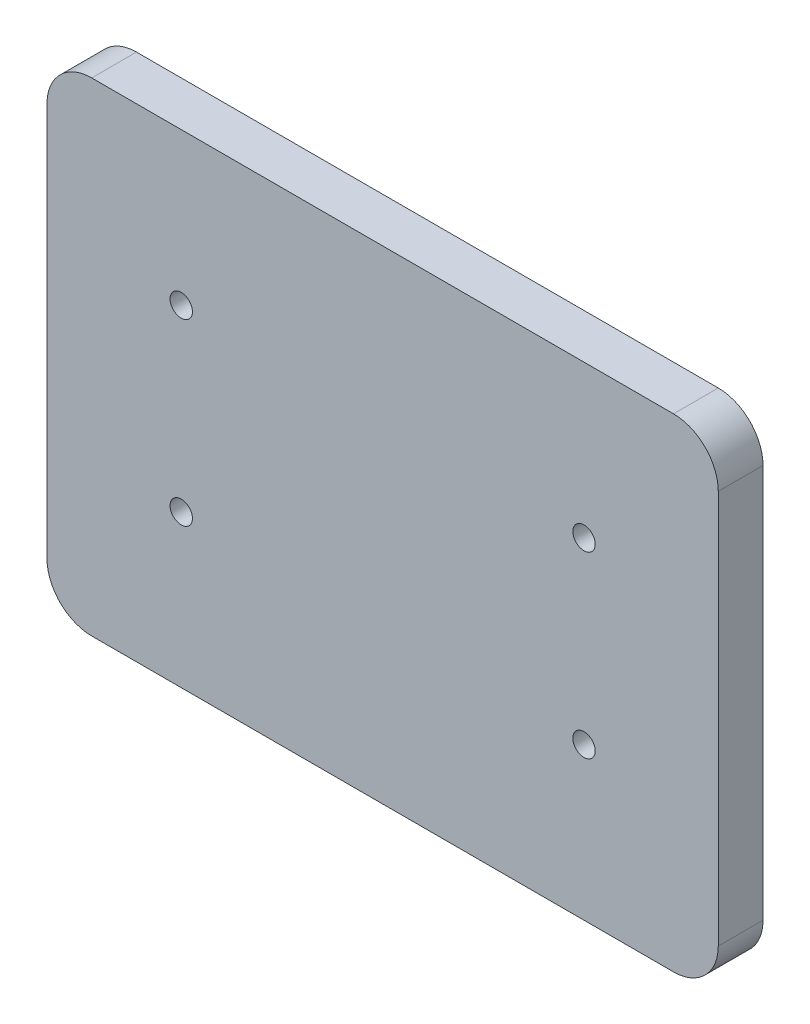
from build123d import *

# Parameters (mm, degrees)
SKETCH1_W                  = 150
SKETCH1_H                  = 108
BOSS_EXTRUDE1_DEPTH        = 10
M6_TAPPED_HOLE1_AT_2_COUNT = 2
M6_TAPPED_HOLE1_AT_2_PITCH = 40
FILLET1_R                  = 10


with BuildPart() as part:
    # Sketch1 → Boss-Extrude1 (new body)
    with BuildSketch(Plane.XY):
        Rectangle(SKETCH1_W, SKETCH1_H)
    extrude(amount=BOSS_EXTRUDE1_DEPTH)

    # Sketch4 → M6 Tapped Hole1 (revolve, cut)
    with BuildSketch(Plane(origin=(-44.997893633, 20, 10), x_dir=(0, -1, 0), z_dir=(1, 0, 0))):
        Polygon((0, 0), (0, 16.502151548), (2.5, 15), (2.5, 0), align=None)
    m6_tapped_hole1 = revolve(axis=Axis((-44.997893633, 20, 16.35), (0, 0, -1)), mode=Mode.SUBTRACT)

    # M6 Tapped Hole1 at 2: M6 Tapped Hole1 ×2
    with Locations(*[(0, -i * M6_TAPPED_HOLE1_AT_2_PITCH, 0) for i in range(1, M6_TAPPED_HOLE1_AT_2_COUNT)]):
        add(m6_tapped_hole1, mode=Mode.SUBTRACT)

    # Mirror1: M6 Tapped Hole1 across plane
    add(m6_tapped_hole1.mirror(Plane(origin=(0, 0, 0), x_dir=(0, 0, 1), z_dir=(1, 0, 0))), mode=Mode.SUBTRACT)

    # Mirror1 copy 1 sketch → Mirror1 copy 1 (revolve, cut)
    with BuildSketch(Plane(origin=(44.997893633, -20, 10), x_dir=(0, -1, 0), z_dir=(-1, 0, 0))):
        Polygon((0, 0), (0, -16.502151548), (2.5, -15), (2.5, 0), align=None)
    revolve(axis=Axis((44.997893633, -20, 16.35), (0, 0, 1)), mode=Mode.SUBTRACT)

    # Fillet1
    fillet1_edges = [part.edges().sort_by_distance(p)[0] for p in [
        (75, -54, 5),
        (-75, -54, 5),
        (-75, 54, 5),
        (75, 54, 5),
    ]]
    fillet(fillet1_edges, radius=FILLET1_R)


solid = part.part
